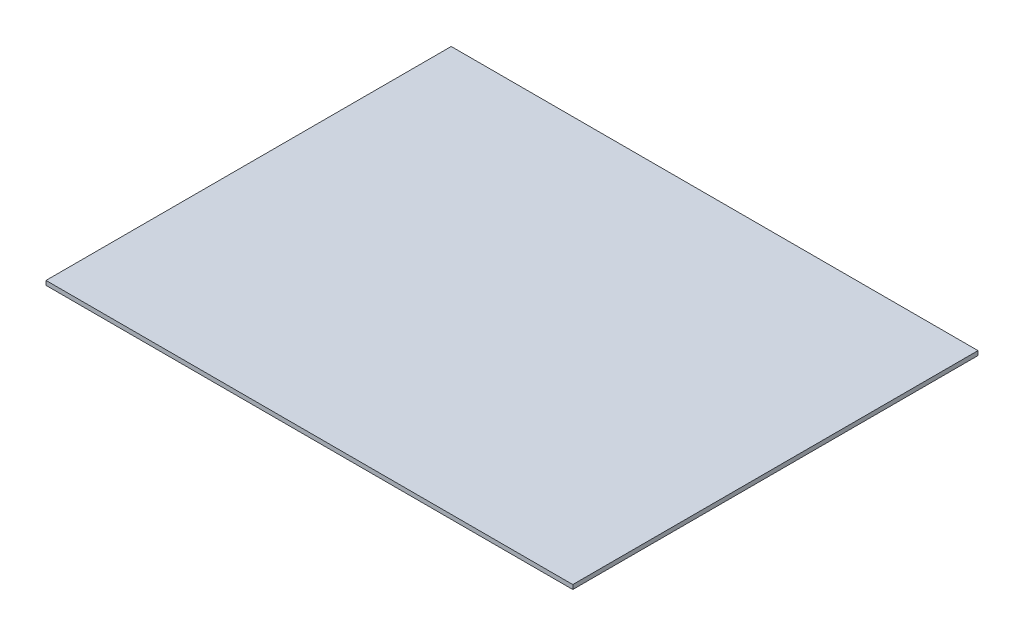
from build123d import *

# Parameters (mm, degrees)
SKETCH3_W           = 914.4
SKETCH3_H           = 2.032
BOSS_EXTRUDE1_DEPTH = 152.4
SKETCH4_OUTSIDE_W   = 1109.172
SKETCH4_OUTSIDE_H   = 499.572
SKETCH4_OUTSIDE_W_2 = 247.65
SKETCH4_OUTSIDE_H_2 = 190.5
CUT_EXTRUDE1_DEPTH  = 482.935399223


with BuildPart() as part:
    # Sketch3 → Boss-Extrude1 (new, symmetric)
    with BuildSketch(Plane.XY):
        Rectangle(SKETCH3_W, SKETCH3_H)
    extrude(amount=BOSS_EXTRUDE1_DEPTH, both=True)

    # Sketch4 outside → Cut-Extrude1 (cut, through all)
    with BuildSketch(Plane(origin=(0, 1.016, 0), x_dir=(1, 0, 0), z_dir=(0, 1, 0))):
        Rectangle(SKETCH4_OUTSIDE_W, SKETCH4_OUTSIDE_H)
        with Locations((-333.375, 57.15)):
            Rectangle(SKETCH4_OUTSIDE_W_2, SKETCH4_OUTSIDE_H_2, mode=Mode.SUBTRACT)
    extrude(amount=-CUT_EXTRUDE1_DEPTH, mode=Mode.SUBTRACT)


solid = part.part
